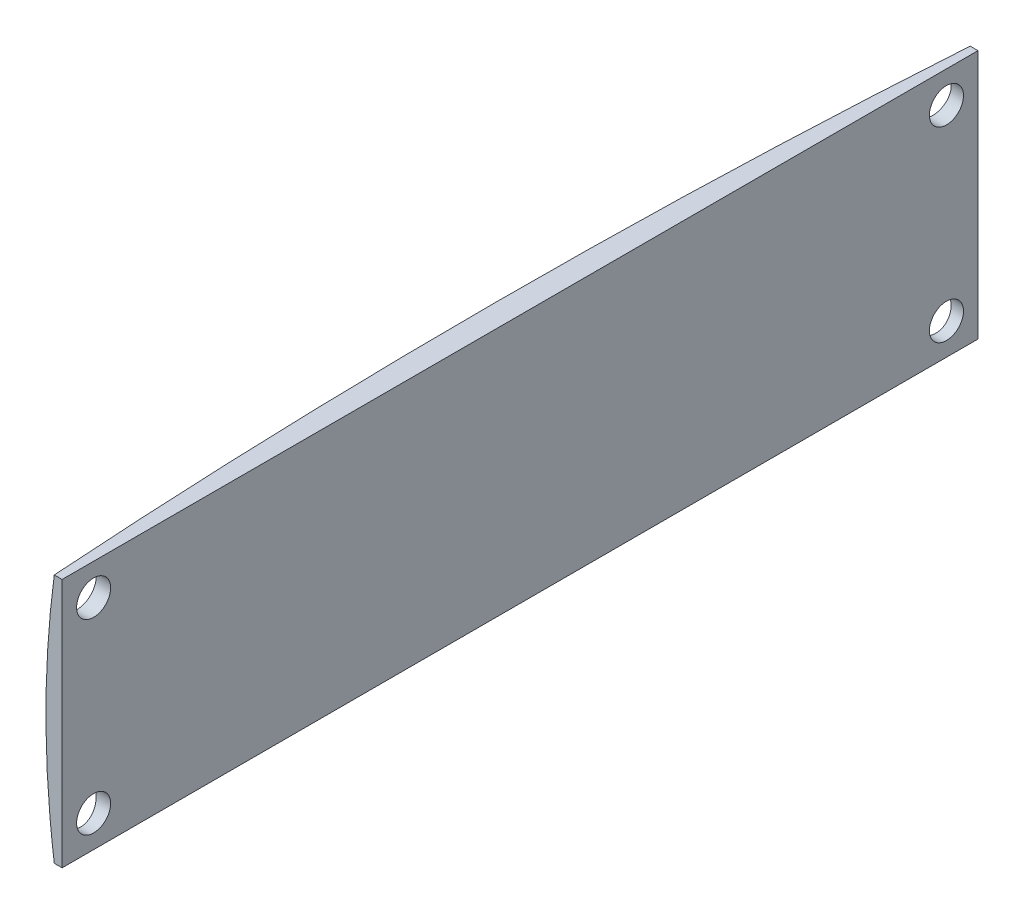
from build123d import *

# Parameters (mm, degrees)
CUT_EXTRUDE2_DEPTH      = 3112.786644088
CUT_EXTRUDE2_DEPTH_BACK = 3112.786644088
SKETCH2_OUTSIDE_W       = 3550.624
SKETCH2_OUTSIDE_H       = 1823.424
SKETCH2_OUTSIDE_W_2     = 184.404
SKETCH2_OUTSIDE_H_2     = 50.292
CUT_EXTRUDE3_START      = 6.35
SKETCH3_W               = 184.404
SKETCH3_H               = 50.292
CUT_EXTRUDE3_DEPTH      = 2742.052714982
SKETCH4_R               = 3.429
CUT_EXTRUDE4_DEPTH      = 96.78023097


with BuildPart() as part:
    # Sketch1 → Revolve1 (revolve)
    with BuildSketch(Plane.XY):
        with BuildLine():
            Line((1372.87, -509.27), (1372.87, 509.27))
            add(Edge.make_bspline(
                [(1372.87, 509.27), (0, 509.27), (0, 0), (0, -509.27), (1372.87, -509.27)],
                knots=[4.71238898, 4.71238898, 4.71238898, 6.283185307, 6.283185307, 7.853981634, 7.853981634, 7.853981634], degree=2, weights=[1, 0.707106781, 1, 0.707106781, 1]))
        make_face()
    revolve(axis=Axis((1372.87, -509.27, 0), (0, 1, 0)))

    # Sketch2 outside → Cut-Extrude2 (cut, two sides: drawn at the far end of the back side and taken through both)
    with BuildSketch(Plane(origin=(0, 0, 0), x_dir=(0, 0, -1), z_dir=(1, 0, 0)).offset(-CUT_EXTRUDE2_DEPTH_BACK)):
        Rectangle(SKETCH2_OUTSIDE_W, SKETCH2_OUTSIDE_H)
        Rectangle(SKETCH2_OUTSIDE_W_2, SKETCH2_OUTSIDE_H_2, mode=Mode.SUBTRACT)
    extrude(amount=CUT_EXTRUDE2_DEPTH + CUT_EXTRUDE2_DEPTH_BACK, mode=Mode.SUBTRACT)

    # Sketch3 → Cut-Extrude3 (cut, through all)
    with BuildSketch(Plane(origin=(0, 0, 0), x_dir=(0, 0, -1), z_dir=(1, 0, 0)).offset(CUT_EXTRUDE3_START)):
        Rectangle(SKETCH3_W, SKETCH3_H)
    extrude(amount=CUT_EXTRUDE3_DEPTH, mode=Mode.SUBTRACT)

    # Sketch4 → Cut-Extrude4 (cut, through all)
    with BuildSketch(Plane(origin=(6.35, 0, 0), x_dir=(0, 0, -1), z_dir=(1, 0, 0))):
        with Locations((-85.852, 18.796)):
            Circle(SKETCH4_R)
        with Locations((-85.852, -18.796)):
            Circle(SKETCH4_R)
        with Locations((85.852, -18.796)):
            Circle(SKETCH4_R)
        with Locations((85.852, 18.796)):
            Circle(SKETCH4_R)
    extrude(amount=-CUT_EXTRUDE4_DEPTH, mode=Mode.SUBTRACT)


solid = part.part
